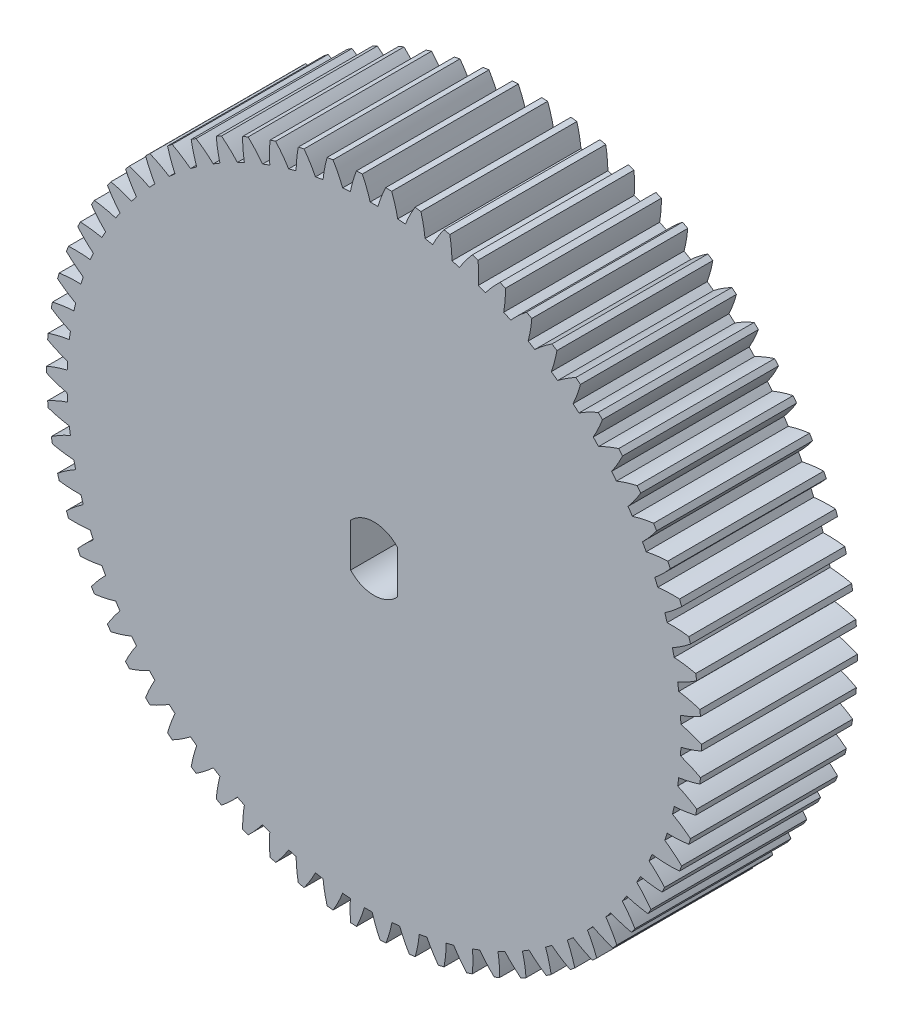
from build123d import *

# Parameters (mm, degrees)
SALIENTE_EXTRUIR1_DEPTH = 12


with BuildPart() as part:
    # Croquis1 → Saliente-Extruir1 (new body)
    with BuildSketch(Plane.XY):
        with BuildLine():
            ThreePointArc((-25.198967769, -0.228086339), (-24.416764854, -0.52912471), (-23.611700211, -0.76222645))
            ThreePointArc((-23.611700211, -0.76222645), (-23.600212204, -1.059886752), (-23.5849719, -1.357378538))
            ThreePointArc((-23.5849719, -1.357378538), (-24.36590051, -1.661707318), (-25.117969635, -2.031649925))
            ThreePointArc((-25.117969635, -2.031649925), (-25.098552209, -2.258910584), (-25.077078631, -2.485986187))
            ThreePointArc((-25.077078631, -2.485986187), (-24.271039764, -2.715696537), (-23.448320995, -2.875694439))
            ThreePointArc((-23.448320995, -2.875694439), (-23.410197172, -3.171126672), (-23.368351262, -3.466054713))
            ThreePointArc((-23.368351262, -3.466054713), (-24.118856263, -3.839160255), (-24.834736379, -4.275028539))
            ThreePointArc((-24.834736379, -4.275028539), (-24.795025633, -4.499633749), (-24.753283602, -4.723870335))
            ThreePointArc((-24.753283602, -4.723870335), (-23.929898532, -4.880403171), (-23.096149686, -4.966009028))
            ThreePointArc((-23.096149686, -4.966009028), (-23.031696997, -5.256834544), (-22.963582401, -5.546824253))
            ThreePointArc((-22.963582401, -5.546824253), (-23.677621166, -5.985702532), (-24.351548427, -6.483987137))
            ThreePointArc((-24.351548427, -6.483987137), (-24.29186409, -6.704128508), (-24.230189687, -6.923720657))
            ThreePointArc((-24.230189687, -6.923720657), (-23.396087829, -7.00581567), (-22.558021761, -7.016340232))
            ThreePointArc((-22.558021761, -7.016340232), (-22.467759141, -7.300217475), (-22.373924277, -7.582934026))
            ThreePointArc((-22.373924277, -7.582934026), (-23.045747786, -8.084051451), (-23.672296127, -8.640740483))
            ThreePointArc((-23.672296127, -8.640740483), (-23.59311874, -8.854645567), (-23.512008532, -9.067825251))
            ThreePointArc((-23.512008532, -9.067825251), (-22.673905583, -9.074821459), (-21.838269908, -9.01017999))
            ThreePointArc((-21.838269908, -9.01017999), (-21.722924099, -9.284823348), (-21.60412447, -9.557990472))
            ThreePointArc((-21.60412447, -9.557990472), (-22.228323596, -10.117312341), (-22.802448417, -10.727923667))
            ThreePointArc((-22.802448417, -10.727923667), (-22.704415471, -10.933870226), (-22.604522509, -11.138921048))
            ThreePointArc((-22.604522509, -11.138921048), (-21.769166381, -11.070762123), (-20.942689146, -10.931475076))
            ThreePointArc((-20.942689146, -10.931475076), (-20.803188845, -11.194673282), (-20.660380956, -11.4560916))
            ThreePointArc((-20.660380956, -11.4560916), (-21.231930014, -12.069114581), (-21.7490088, -12.728731917))
            ThreePointArc((-21.7490088, -12.728731917), (-21.632909599, -12.925061791), (-21.515038163, -13.120332803))
            ThreePointArc((-21.515038163, -13.120332803), (-20.689154651, -12.977567519), (-19.878490165, -12.764756353))
            ThreePointArc((-19.878490165, -12.764756353), (-19.715958546, -13.01439029), (-19.550292203, -13.261955014))
            ThreePointArc((-19.550292203, -13.261955014), (-20.064589416, -13.923743407), (-20.520458952, -14.627055903))
            ThreePointArc((-20.520458952, -14.627055903), (-20.387228258, -14.812188358), (-20.252327379, -14.996107352))
            ThreePointArc((-20.252327379, -14.996107352), (-19.442566013, -14.779885172), (-18.65424127, -14.495263317))
            ThreePointArc((-18.65424127, -14.495263317), (-18.469986942, -14.729323079), (-18.282795992, -14.961040964))
            ThreePointArc((-18.282795992, -14.961040964), (-18.735700541, -15.666266439), (-19.126690435, -16.407611435))
            ThreePointArc((-19.126690435, -16.407611435), (-18.977400943, -16.580055894), (-18.826556764, -16.751142063))
            ThreePointArc((-18.826556764, -16.751142063), (-18.039437266, -16.46320388), (-17.279799393, -16.109062944))
            ThreePointArc((-17.279799393, -16.109062944), (-17.075305863, -16.32566402), (-16.868097458, -16.539669409))
            ThreePointArc((-16.868097458, -16.539669409), (-17.255962822, -17.282653904), (-17.578925053, -18.056062527))
            ThreePointArc((-17.578925053, -18.056062527), (-17.414778754, -18.214430568), (-17.249205784, -18.371306427))
            ThreePointArc((-17.249205784, -18.371306427), (-16.491065577, -18.013970551), (-15.766230731, -17.593161868))
            ThreePointArc((-15.766230731, -17.593161868), (-15.543144462, -17.790560313), (-15.317586921, -17.985130161))
            ThreePointArc((-15.317586921, -17.985130161), (-15.637290237, -18.759891602), (-15.889624502, -19.559136821))
            ThreePointArc((-15.889624502, -19.559136821), (-15.711943007, -19.702153358), (-15.532974341, -19.843555834))
            ThreePointArc((-15.532974341, -19.843555834), (-14.809917524, -19.419699323), (-14.12572165, -18.935610998))
            ThreePointArc((-14.12572165, -18.935610998), (-13.8858388, -19.112217475), (-13.643748182, -19.28578522))
            ThreePointArc((-13.643748182, -19.28578522), (-13.892715386, -20.086085684), (-14.072390038, -20.904732446))
            ThreePointArc((-14.072390038, -20.904732446), (-13.882603933, -21.031245994), (-13.691680521, -21.156036597))
            ThreePointArc((-13.691680521, -21.156036597), (-13.009528724, -20.669072095), (-12.371480564, -20.125601721))
            ThreePointArc((-12.371480564, -20.125601721), (-12.116732529, -20.2799943), (-11.860058004, -20.431162477))
            ThreePointArc((-11.860058004, -20.431162477), (-12.036284559, -21.250558414), (-12.141852964, -22.082015456))
            ThreePointArc((-12.141852964, -22.082015456), (-11.941490294, -22.191007403), (-11.740149341, -22.298181393))
            ThreePointArc((-11.740149341, -22.298181393), (-11.104394848, -21.752029651), (-10.517631591, -21.153552933))
            ThreePointArc((-10.517631591, -21.153552933), (-10.250069453, -21.284488535), (-9.980877613, -21.412040026))
            ThreePointArc((-9.980877613, -21.412040026), (-10.082944645, -22.243934143), (-10.113556829, -23.081507063))
            ThreePointArc((-10.113556829, -23.081507063), (-9.904230798, -23.172099868), (-9.694093382, -23.260794344))
            ThreePointArc((-9.694093382, -23.260794344), (-9.109854914, -22.659852655), (-8.579100833, -22.011188176))
            ThreePointArc((-8.579100833, -22.011188176), (-8.300878844, -22.117612584), (-8.021337063, -22.22052042))
            ThreePointArc((-8.021337063, -22.22052042), (-8.048422791, -23.058214794), (-8.003832281, -23.895159946))
            ThreePointArc((-8.003832281, -23.895159946), (-7.787228258, -23.966624211), (-7.569986282, -24.036125056))
            ThreePointArc((-7.569986282, -24.036125056), (-7.041967784, -23.385231849), (-6.571496199, -22.691602273))
            ThreePointArc((-6.571496199, -22.691602273), (-6.28485444, -22.772658621), (-5.997213425, -22.850094248))
            ThreePointArc((-5.997213425, -22.850094248), (-5.949099768, -23.686844257), (-5.829665581, -24.516423051))
            ThreePointArc((-5.829665581, -24.516423051), (-5.607527536, -24.568183387), (-5.384930104, -24.617931021))
            ThreePointArc((-5.384930104, -24.617931021), (-4.917382871, -23.922326906), (-4.510981742, -23.189316931))
            ThreePointArc((-4.510981742, -23.189316931), (-4.218228083, -23.244352601), (-3.92480375, -23.295692553))
            ThreePointArc((-3.92480375, -23.295692553), (-3.801878092, -24.124761177), (-3.608561842, -24.940294333))
            ThreePointArc((-3.608561842, -24.940294333), (-3.382678299, -24.971933997), (-3.156517635, -25.001527882))
            ThreePointArc((-3.156517635, -25.001527882), (-2.753206082, -24.266813453), (-2.414147512, -23.500324844))
            ThreePointArc((-2.414147512, -23.500324844), (-2.117639034, -23.528896721), (-1.820793863, -23.553727639))
            ThreePointArc((-1.820793863, -23.553727639), (-1.843503057, -24.358972012), (-1.8, -25.16336103))
            ThreePointArc((-1.8, -25.16336103), (-1.572189639, -25.174625277), (-1.344286657, -25.18382714))
            ThreePointArc((-1.344286657, -25.18382714), (-1.008458011, -24.415917887), (-0.7394719, -23.62212196))
            ThreePointArc((-0.7394719, -23.62212196), (-0.441595915, -23.624), (-0.143719929, -23.62212196))
            ThreePointArc((-0.143719929, -23.62212196), (0.125266182, -24.415917887), (0.461094828, -25.18382714))
            ThreePointArc((0.461094828, -25.18382714), (0.68899781, -25.174625277), (0.916808171, -25.16336103))
            ThreePointArc((0.916808171, -25.16336103), (1.182450015, -24.368439706), (1.379197948, -23.553727639))
            ThreePointArc((1.379197948, -23.553727639), (1.676043119, -23.528896721), (1.972551597, -23.500324844))
            ThreePointArc((1.972551597, -23.500324844), (2.311610167, -24.266813453), (2.714921721, -25.001527882))
            ThreePointArc((2.714921721, -25.001527882), (2.941082384, -24.971933997), (3.166965928, -24.940294333))
            ThreePointArc((3.166965928, -24.940294333), (3.360282178, -24.124761177), (3.483207835, -23.295692553))
            ThreePointArc((3.483207835, -23.295692553), (3.776632168, -23.244352601), (4.069385827, -23.189316931))
            ThreePointArc((4.069385827, -23.189316931), (4.475786956, -23.922326906), (4.94333419, -24.617931021))
            ThreePointArc((4.94333419, -24.617931021), (5.165931621, -24.568183387), (5.388069667, -24.516423051))
            ThreePointArc((5.388069667, -24.516423051), (5.507503854, -23.686844257), (5.55561751, -22.850094248))
            ThreePointArc((5.55561751, -22.850094248), (5.843258525, -22.772658621), (6.129900284, -22.691602273))
            ThreePointArc((6.129900284, -22.691602273), (6.60037187, -23.385231849), (7.128390368, -24.036125056))
            ThreePointArc((7.128390368, -24.036125056), (7.345632344, -23.966624211), (7.562236366, -23.895159946))
            ThreePointArc((7.562236366, -23.895159946), (7.606826876, -23.058214794), (7.579741149, -22.22052042))
            ThreePointArc((7.579741149, -22.22052042), (7.85928293, -22.117612584), (8.137504918, -22.011188176))
            ThreePointArc((8.137504918, -22.011188176), (8.668258999, -22.659852655), (9.252497467, -23.260794344))
            ThreePointArc((9.252497467, -23.260794344), (9.462634883, -23.172099868), (9.671960914, -23.081507063))
            ThreePointArc((9.671960914, -23.081507063), (9.641348731, -22.243934143), (9.539281698, -21.412040026))
            ThreePointArc((9.539281698, -21.412040026), (9.808473538, -21.284488535), (10.076035677, -21.153552933))
            ThreePointArc((10.076035677, -21.153552933), (10.662798933, -21.752029651), (11.298553427, -22.298181393))
            ThreePointArc((11.298553427, -22.298181393), (11.49989438, -22.191007403), (11.700257049, -22.082015456))
            ThreePointArc((11.700257049, -22.082015456), (11.594688644, -21.250558414), (11.418462089, -20.431162477))
            ThreePointArc((11.418462089, -20.431162477), (11.675136615, -20.2799943), (11.92988465, -20.125601721))
            ThreePointArc((11.92988465, -20.125601721), (12.56793281, -20.669072095), (13.250084607, -21.156036597))
            ThreePointArc((13.250084607, -21.156036597), (13.441008018, -21.031245994), (13.630794123, -20.904732446))
            ThreePointArc((13.630794123, -20.904732446), (13.451119471, -20.086085684), (13.202152267, -19.28578522))
            ThreePointArc((13.202152267, -19.28578522), (13.444242886, -19.112217475), (13.684125736, -18.935610998))
            ThreePointArc((13.684125736, -18.935610998), (14.36832161, -19.419699323), (15.091378426, -19.843555834))
            ThreePointArc((15.091378426, -19.843555834), (15.270347092, -19.702153358), (15.448028588, -19.559136821))
            ThreePointArc((15.448028588, -19.559136821), (15.195694323, -18.759891602), (14.875991007, -17.985130161))
            ThreePointArc((14.875991007, -17.985130161), (15.101548547, -17.790560313), (15.324634817, -17.593161868))
            ThreePointArc((15.324634817, -17.593161868), (16.049469662, -18.013970551), (16.807609869, -18.371306427))
            ThreePointArc((16.807609869, -18.371306427), (16.97318284, -18.214430568), (17.137329138, -18.056062527))
            ThreePointArc((17.137329138, -18.056062527), (16.814366908, -17.282653904), (16.426501543, -16.539669409))
            ThreePointArc((16.426501543, -16.539669409), (16.633709948, -16.32566402), (16.838203478, -16.109062944))
            ThreePointArc((16.838203478, -16.109062944), (17.597841352, -16.46320388), (18.38496085, -16.751142063))
            ThreePointArc((18.38496085, -16.751142063), (18.535805029, -16.580055894), (18.68509452, -16.407611435))
            ThreePointArc((18.68509452, -16.407611435), (18.294104626, -15.666266439), (17.841200077, -14.961040964))
            ThreePointArc((17.841200077, -14.961040964), (18.028391027, -14.729323079), (18.212645356, -14.495263317))
            ThreePointArc((18.212645356, -14.495263317), (19.000970099, -14.779885172), (19.810731465, -14.996107352))
            ThreePointArc((19.810731465, -14.996107352), (19.945632344, -14.812188358), (20.078863038, -14.627055903))
            ThreePointArc((20.078863038, -14.627055903), (19.622993501, -13.923743407), (19.108696288, -13.261955014))
            ThreePointArc((19.108696288, -13.261955014), (19.274362631, -13.01439029), (19.436894251, -12.764756353))
            ThreePointArc((19.436894251, -12.764756353), (20.247558737, -12.977567519), (21.073442248, -13.120332803))
            ThreePointArc((21.073442248, -13.120332803), (21.191313684, -12.925061791), (21.307412885, -12.728731917))
            ThreePointArc((21.307412885, -12.728731917), (20.790334099, -12.069114581), (20.218785042, -11.4560916))
            ThreePointArc((20.218785042, -11.4560916), (20.36159293, -11.194673282), (20.501093231, -10.931475076))
            ThreePointArc((20.501093231, -10.931475076), (21.327570466, -11.070762123), (22.162926595, -11.138921048))
            ThreePointArc((22.162926595, -11.138921048), (22.262819557, -10.933870226), (22.360852502, -10.727923667))
            ThreePointArc((22.360852502, -10.727923667), (21.786727681, -10.117312341), (21.162528556, -9.557990472))
            ThreePointArc((21.162528556, -9.557990472), (21.281328184, -9.284823348), (21.396673993, -9.01017999))
            ThreePointArc((21.396673993, -9.01017999), (22.45278078, -9.096265662), (23.512008532, -9.067825251))
            ThreePointArc((23.512008532, -9.067825251), (23.59311874, -8.854645567), (23.672296127, -8.640740483))
            ThreePointArc((23.672296127, -8.640740483), (23.045747786, -8.084051451), (22.373924277, -7.582934026))
            ThreePointArc((22.373924277, -7.582934026), (22.467759141, -7.300217475), (22.558021761, -7.016340232))
            ThreePointArc((22.558021761, -7.016340232), (23.396087829, -7.00581567), (24.230189687, -6.923720657))
            ThreePointArc((24.230189687, -6.923720657), (24.29186409, -6.704128508), (24.351548427, -6.483987137))
            ThreePointArc((24.351548427, -6.483987137), (23.677621166, -5.985702532), (22.963582401, -5.546824253))
            ThreePointArc((22.963582401, -5.546824253), (23.031696997, -5.256834544), (23.096149686, -4.966009028))
            ThreePointArc((23.096149686, -4.966009028), (23.929898532, -4.880403171), (24.753283602, -4.723870335))
            ThreePointArc((24.753283602, -4.723870335), (24.795025633, -4.499633749), (24.834736379, -4.275028539))
            ThreePointArc((24.834736379, -4.275028539), (24.118856263, -3.839160255), (23.368351262, -3.466054713))
            ThreePointArc((23.368351262, -3.466054713), (23.410197172, -3.171126672), (23.448320995, -2.875694439))
            ThreePointArc((23.448320995, -2.875694439), (24.271039764, -2.715696537), (25.077078631, -2.485986187))
            ThreePointArc((25.077078631, -2.485986187), (25.098552209, -2.258910584), (25.117969635, -2.031649925))
            ThreePointArc((25.117969635, -2.031649925), (24.36590051, -1.661707318), (23.5849719, -1.357378538))
            ThreePointArc((23.5849719, -1.357378538), (23.600212204, -1.059886752), (23.611700211, -0.76222645))
            ThreePointArc((23.611700211, -0.76222645), (24.416764854, -0.52912471), (25.198967769, -0.228086339))
            ThreePointArc((25.198967769, -0.228086339), (25.2, 0), (25.198967769, 0.228086339))
            ThreePointArc((25.198967769, 0.228086339), (24.416764854, 0.52912471), (23.611700211, 0.76222645))
            ThreePointArc((23.611700211, 0.76222645), (23.600212204, 1.059886752), (23.5849719, 1.357378538))
            ThreePointArc((23.5849719, 1.357378538), (24.36590051, 1.661707318), (25.117969635, 2.031649925))
            ThreePointArc((25.117969635, 2.031649925), (25.098552209, 2.258910584), (25.077078631, 2.485986187))
            ThreePointArc((25.077078631, 2.485986187), (24.271039764, 2.715696537), (23.448320995, 2.875694439))
            ThreePointArc((23.448320995, 2.875694439), (23.410197172, 3.171126672), (23.368351262, 3.466054713))
            ThreePointArc((23.368351262, 3.466054713), (24.118856263, 3.839160255), (24.834736379, 4.275028539))
            ThreePointArc((24.834736379, 4.275028539), (24.795025633, 4.499633749), (24.753283602, 4.723870335))
            ThreePointArc((24.753283602, 4.723870335), (23.929898532, 4.880403171), (23.096149686, 4.966009028))
            ThreePointArc((23.096149686, 4.966009028), (23.031696997, 5.256834544), (22.963582401, 5.546824253))
            ThreePointArc((22.963582401, 5.546824253), (23.677621166, 5.985702532), (24.351548427, 6.483987137))
            ThreePointArc((24.351548427, 6.483987137), (24.29186409, 6.704128508), (24.230189687, 6.923720657))
            ThreePointArc((24.230189687, 6.923720657), (23.396087829, 7.00581567), (22.558021761, 7.016340232))
            ThreePointArc((22.558021761, 7.016340232), (22.467759141, 7.300217475), (22.373924277, 7.582934026))
            ThreePointArc((22.373924277, 7.582934026), (23.045747786, 8.084051451), (23.672296127, 8.640740483))
            ThreePointArc((23.672296127, 8.640740483), (23.59311874, 8.854645567), (23.512008532, 9.067825251))
            ThreePointArc((23.512008532, 9.067825251), (22.673905583, 9.074821459), (21.838269908, 9.01017999))
            ThreePointArc((21.838269908, 9.01017999), (21.722924099, 9.284823348), (21.60412447, 9.557990472))
            ThreePointArc((21.60412447, 9.557990472), (22.228323596, 10.117312341), (22.802448417, 10.727923667))
            ThreePointArc((22.802448417, 10.727923667), (22.704415471, 10.933870226), (22.604522509, 11.138921048))
            ThreePointArc((22.604522509, 11.138921048), (21.769166381, 11.070762123), (20.942689146, 10.931475076))
            ThreePointArc((20.942689146, 10.931475076), (20.803188845, 11.194673282), (20.660380956, 11.4560916))
            ThreePointArc((20.660380956, 11.4560916), (21.231930014, 12.069114581), (21.7490088, 12.728731917))
            ThreePointArc((21.7490088, 12.728731917), (21.632909599, 12.925061791), (21.515038163, 13.120332803))
            ThreePointArc((21.515038163, 13.120332803), (20.689154651, 12.977567519), (19.878490165, 12.764756353))
            ThreePointArc((19.878490165, 12.764756353), (19.715958546, 13.01439029), (19.550292203, 13.261955014))
            ThreePointArc((19.550292203, 13.261955014), (20.064589416, 13.923743407), (20.520458952, 14.627055903))
            ThreePointArc((20.520458952, 14.627055903), (20.387228258, 14.812188358), (20.252327379, 14.996107352))
            ThreePointArc((20.252327379, 14.996107352), (19.442566013, 14.779885172), (18.65424127, 14.495263317))
            ThreePointArc((18.65424127, 14.495263317), (18.469986942, 14.729323079), (18.282795992, 14.961040964))
            ThreePointArc((18.282795992, 14.961040964), (18.735700541, 15.666266439), (19.126690435, 16.407611435))
            ThreePointArc((19.126690435, 16.407611435), (18.977400943, 16.580055894), (18.826556764, 16.751142063))
            ThreePointArc((18.826556764, 16.751142063), (18.039437266, 16.46320388), (17.279799393, 16.109062944))
            ThreePointArc((17.279799393, 16.109062944), (17.075305863, 16.32566402), (16.868097458, 16.539669409))
            ThreePointArc((16.868097458, 16.539669409), (17.255962822, 17.282653904), (17.578925053, 18.056062527))
            ThreePointArc((17.578925053, 18.056062527), (17.414778754, 18.214430568), (17.249205784, 18.371306427))
            ThreePointArc((17.249205784, 18.371306427), (16.491065577, 18.013970551), (15.766230731, 17.593161868))
            ThreePointArc((15.766230731, 17.593161868), (15.543144462, 17.790560313), (15.317586921, 17.985130161))
            ThreePointArc((15.317586921, 17.985130161), (15.637290237, 18.759891602), (15.889624502, 19.559136821))
            ThreePointArc((15.889624502, 19.559136821), (15.711943007, 19.702153358), (15.532974341, 19.843555834))
            ThreePointArc((15.532974341, 19.843555834), (14.809917524, 19.419699323), (14.12572165, 18.935610998))
            ThreePointArc((14.12572165, 18.935610998), (13.8858388, 19.112217475), (13.643748182, 19.28578522))
            ThreePointArc((13.643748182, 19.28578522), (13.892715386, 20.086085684), (14.072390038, 20.904732446))
            ThreePointArc((14.072390038, 20.904732446), (13.882603933, 21.031245994), (13.691680521, 21.156036597))
            ThreePointArc((13.691680521, 21.156036597), (13.009528724, 20.669072095), (12.371480564, 20.125601721))
            ThreePointArc((12.371480564, 20.125601721), (12.116732529, 20.2799943), (11.860058004, 20.431162477))
            ThreePointArc((11.860058004, 20.431162477), (12.036284559, 21.250558414), (12.141852964, 22.082015456))
            ThreePointArc((12.141852964, 22.082015456), (11.941490294, 22.191007403), (11.740149341, 22.298181393))
            ThreePointArc((11.740149341, 22.298181393), (11.104394848, 21.752029651), (10.517631591, 21.153552933))
            ThreePointArc((10.517631591, 21.153552933), (10.250069453, 21.284488535), (9.980877613, 21.412040026))
            ThreePointArc((9.980877613, 21.412040026), (10.082944645, 22.243934143), (10.113556829, 23.081507063))
            ThreePointArc((10.113556829, 23.081507063), (9.904230798, 23.172099868), (9.694093382, 23.260794344))
            ThreePointArc((9.694093382, 23.260794344), (9.109854914, 22.659852655), (8.579100833, 22.011188176))
            ThreePointArc((8.579100833, 22.011188176), (8.300878844, 22.117612584), (8.021337063, 22.22052042))
            ThreePointArc((8.021337063, 22.22052042), (8.048422791, 23.058214794), (8.003832281, 23.895159946))
            ThreePointArc((8.003832281, 23.895159946), (7.787228258, 23.966624211), (7.569986282, 24.036125056))
            ThreePointArc((7.569986282, 24.036125056), (7.041967784, 23.385231849), (6.571496199, 22.691602273))
            ThreePointArc((6.571496199, 22.691602273), (6.28485444, 22.772658621), (5.997213425, 22.850094248))
            ThreePointArc((5.997213425, 22.850094248), (5.949099768, 23.686844257), (5.829665581, 24.516423051))
            ThreePointArc((5.829665581, 24.516423051), (5.607527536, 24.568183387), (5.384930104, 24.617931021))
            ThreePointArc((5.384930104, 24.617931021), (4.917382871, 23.922326906), (4.510981742, 23.189316931))
            ThreePointArc((4.510981742, 23.189316931), (4.218228083, 23.244352601), (3.92480375, 23.295692553))
            ThreePointArc((3.92480375, 23.295692553), (3.801878092, 24.124761177), (3.608561842, 24.940294333))
            ThreePointArc((3.608561842, 24.940294333), (3.382678299, 24.971933997), (3.156517635, 25.001527882))
            ThreePointArc((3.156517635, 25.001527882), (2.753206082, 24.266813453), (2.414147512, 23.500324844))
            ThreePointArc((2.414147512, 23.500324844), (2.117639034, 23.528896721), (1.820793863, 23.553727639))
            ThreePointArc((1.820793863, 23.553727639), (1.624045929, 24.368439706), (1.358404085, 25.16336103))
            ThreePointArc((1.358404085, 25.16336103), (1.130593725, 25.174625277), (0.902690742, 25.18382714))
            ThreePointArc((0.902690742, 25.18382714), (0.566862096, 24.415917887), (0.297875985, 23.62212196))
            ThreePointArc((0.297875985, 23.62212196), (0, 23.624), (-0.297875985, 23.62212196))
            ThreePointArc((-0.297875985, 23.62212196), (-0.566862096, 24.415917887), (-0.902690742, 25.18382714))
            ThreePointArc((-0.902690742, 25.18382714), (-1.130593725, 25.174625277), (-1.358404085, 25.16336103))
            ThreePointArc((-1.358404085, 25.16336103), (-1.624045929, 24.368439706), (-1.820793863, 23.553727639))
            ThreePointArc((-1.820793863, 23.553727639), (-2.117639034, 23.528896721), (-2.414147512, 23.500324844))
            ThreePointArc((-2.414147512, 23.500324844), (-2.753206082, 24.266813453), (-3.156517635, 25.001527882))
            ThreePointArc((-3.156517635, 25.001527882), (-3.382678299, 24.971933997), (-3.608561842, 24.940294333))
            ThreePointArc((-3.608561842, 24.940294333), (-3.801878092, 24.124761177), (-3.92480375, 23.295692553))
            ThreePointArc((-3.92480375, 23.295692553), (-4.218228083, 23.244352601), (-4.510981742, 23.189316931))
            ThreePointArc((-4.510981742, 23.189316931), (-4.917382871, 23.922326906), (-5.384930104, 24.617931021))
            ThreePointArc((-5.384930104, 24.617931021), (-5.607527536, 24.568183387), (-5.829665581, 24.516423051))
            ThreePointArc((-5.829665581, 24.516423051), (-5.949099768, 23.686844257), (-5.997213425, 22.850094248))
            ThreePointArc((-5.997213425, 22.850094248), (-6.28485444, 22.772658621), (-6.571496199, 22.691602273))
            ThreePointArc((-6.571496199, 22.691602273), (-7.041967784, 23.385231849), (-7.569986282, 24.036125056))
            ThreePointArc((-7.569986282, 24.036125056), (-7.787228258, 23.966624211), (-8.003832281, 23.895159946))
            ThreePointArc((-8.003832281, 23.895159946), (-8.048422791, 23.058214794), (-8.021337063, 22.22052042))
            ThreePointArc((-8.021337063, 22.22052042), (-8.300878844, 22.117612584), (-8.579100833, 22.011188176))
            ThreePointArc((-8.579100833, 22.011188176), (-9.109854914, 22.659852655), (-9.694093382, 23.260794344))
            ThreePointArc((-9.694093382, 23.260794344), (-9.904230798, 23.172099868), (-10.113556829, 23.081507063))
            ThreePointArc((-10.113556829, 23.081507063), (-10.082944645, 22.243934143), (-9.980877613, 21.412040026))
            ThreePointArc((-9.980877613, 21.412040026), (-10.250069453, 21.284488535), (-10.517631591, 21.153552933))
            ThreePointArc((-10.517631591, 21.153552933), (-11.104394848, 21.752029651), (-11.740149341, 22.298181393))
            ThreePointArc((-11.740149341, 22.298181393), (-11.941490294, 22.191007403), (-12.141852964, 22.082015456))
            ThreePointArc((-12.141852964, 22.082015456), (-12.036284559, 21.250558414), (-11.860058004, 20.431162477))
            ThreePointArc((-11.860058004, 20.431162477), (-12.116732529, 20.2799943), (-12.371480564, 20.125601721))
            ThreePointArc((-12.371480564, 20.125601721), (-13.009528724, 20.669072095), (-13.691680521, 21.156036597))
            ThreePointArc((-13.691680521, 21.156036597), (-13.882603933, 21.031245994), (-14.072390038, 20.904732446))
            ThreePointArc((-14.072390038, 20.904732446), (-13.892715386, 20.086085684), (-13.643748182, 19.28578522))
            ThreePointArc((-13.643748182, 19.28578522), (-13.8858388, 19.112217475), (-14.12572165, 18.935610998))
            ThreePointArc((-14.12572165, 18.935610998), (-14.809917524, 19.419699323), (-15.532974341, 19.843555834))
            ThreePointArc((-15.532974341, 19.843555834), (-15.711943007, 19.702153358), (-15.889624502, 19.559136821))
            ThreePointArc((-15.889624502, 19.559136821), (-15.637290237, 18.759891602), (-15.317586921, 17.985130161))
            ThreePointArc((-15.317586921, 17.985130161), (-15.543144462, 17.790560313), (-15.766230731, 17.593161868))
            ThreePointArc((-15.766230731, 17.593161868), (-16.491065577, 18.013970551), (-17.249205784, 18.371306427))
            ThreePointArc((-17.249205784, 18.371306427), (-17.414778754, 18.214430568), (-17.578925053, 18.056062527))
            ThreePointArc((-17.578925053, 18.056062527), (-17.255962822, 17.282653904), (-16.868097458, 16.539669409))
            ThreePointArc((-16.868097458, 16.539669409), (-17.075305863, 16.32566402), (-17.279799393, 16.109062944))
            ThreePointArc((-17.279799393, 16.109062944), (-18.039437266, 16.46320388), (-18.826556764, 16.751142063))
            ThreePointArc((-18.826556764, 16.751142063), (-18.977400943, 16.580055894), (-19.126690435, 16.407611435))
            ThreePointArc((-19.126690435, 16.407611435), (-18.735700541, 15.666266439), (-18.282795992, 14.961040964))
            ThreePointArc((-18.282795992, 14.961040964), (-18.469986942, 14.729323079), (-18.65424127, 14.495263317))
            ThreePointArc((-18.65424127, 14.495263317), (-19.442566013, 14.779885172), (-20.252327379, 14.996107352))
            ThreePointArc((-20.252327379, 14.996107352), (-20.387228258, 14.812188358), (-20.520458952, 14.627055903))
            ThreePointArc((-20.520458952, 14.627055903), (-20.064589416, 13.923743407), (-19.550292203, 13.261955014))
            ThreePointArc((-19.550292203, 13.261955014), (-19.715958546, 13.01439029), (-19.878490165, 12.764756353))
            ThreePointArc((-19.878490165, 12.764756353), (-20.689154651, 12.977567519), (-21.515038163, 13.120332803))
            ThreePointArc((-21.515038163, 13.120332803), (-21.632909599, 12.925061791), (-21.7490088, 12.728731917))
            ThreePointArc((-21.7490088, 12.728731917), (-21.231930014, 12.069114581), (-20.660380956, 11.4560916))
            ThreePointArc((-20.660380956, 11.4560916), (-20.803188845, 11.194673282), (-20.942689146, 10.931475076))
            ThreePointArc((-20.942689146, 10.931475076), (-21.769166381, 11.070762123), (-22.604522509, 11.138921048))
            ThreePointArc((-22.604522509, 11.138921048), (-22.704415471, 10.933870226), (-22.802448417, 10.727923667))
            ThreePointArc((-22.802448417, 10.727923667), (-22.228323596, 10.117312341), (-21.60412447, 9.557990472))
            ThreePointArc((-21.60412447, 9.557990472), (-21.722924099, 9.284823348), (-21.838269908, 9.01017999))
            ThreePointArc((-21.838269908, 9.01017999), (-22.673905583, 9.074821459), (-23.512008532, 9.067825251))
            ThreePointArc((-23.512008532, 9.067825251), (-23.59311874, 8.854645567), (-23.672296127, 8.640740483))
            ThreePointArc((-23.672296127, 8.640740483), (-23.045747786, 8.084051451), (-22.373924277, 7.582934026))
            ThreePointArc((-22.373924277, 7.582934026), (-22.467759141, 7.300217475), (-22.558021761, 7.016340232))
            ThreePointArc((-22.558021761, 7.016340232), (-23.396087829, 7.00581567), (-24.230189687, 6.923720657))
            ThreePointArc((-24.230189687, 6.923720657), (-24.29186409, 6.704128508), (-24.351548427, 6.483987137))
            ThreePointArc((-24.351548427, 6.483987137), (-23.677621166, 5.985702532), (-22.963582401, 5.546824253))
            ThreePointArc((-22.963582401, 5.546824253), (-23.031696997, 5.256834544), (-23.096149686, 4.966009028))
            ThreePointArc((-23.096149686, 4.966009028), (-23.929898532, 4.880403171), (-24.753283602, 4.723870335))
            ThreePointArc((-24.753283602, 4.723870335), (-24.795025633, 4.499633749), (-24.834736379, 4.275028539))
            ThreePointArc((-24.834736379, 4.275028539), (-24.118856263, 3.839160255), (-23.368351262, 3.466054713))
            ThreePointArc((-23.368351262, 3.466054713), (-23.410197172, 3.171126672), (-23.448320995, 2.875694439))
            ThreePointArc((-23.448320995, 2.875694439), (-24.271039764, 2.715696537), (-25.077078631, 2.485986187))
            ThreePointArc((-25.077078631, 2.485986187), (-25.098552209, 2.258910584), (-25.117969635, 2.031649925))
            ThreePointArc((-25.117969635, 2.031649925), (-24.36590051, 1.661707318), (-23.5849719, 1.357378538))
            ThreePointArc((-23.5849719, 1.357378538), (-23.600212204, 1.059886752), (-23.611700211, 0.76222645))
            ThreePointArc((-23.611700211, 0.76222645), (-24.416764854, 0.52912471), (-25.198967769, 0.228086339))
            ThreePointArc((-25.198967769, 0.228086339), (-25.2, 0), (-25.198967769, -0.228086339))
        make_face()
        with BuildLine():
            Line((-1.8, 1.662077014), (-1.8, -1.662077014))
            ThreePointArc((-1.8, -1.662077014), (0, -2.45), (1.8, -1.662077014))
            Line((1.8, -1.662077014), (1.8, 1.662077014))
            ThreePointArc((1.8, 1.662077014), (0, 2.45), (-1.8, 1.662077014))
        make_face(mode=Mode.SUBTRACT)
    extrude(amount=SALIENTE_EXTRUIR1_DEPTH)


solid = part.part
